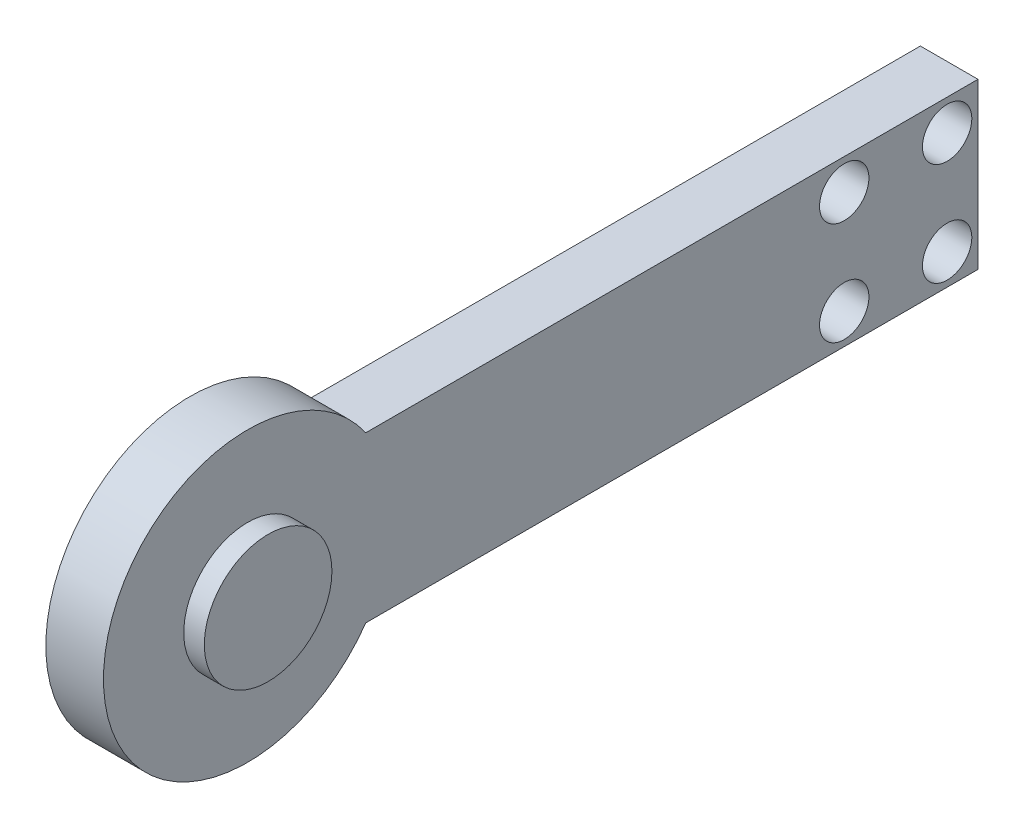
from build123d import *

# Parameters (mm, degrees)
EXTRUDE_1_DEPTH          = 14
SKETCH_4_R               = 15.5
EXTRUDE_2_DEPTH          = 5
CUT_EXTRUDE_1_DEPTH      = 182.405486002
CUT_EXTRUDE_1_DEPTH_BACK = 182.405486002
SKETCH_5_R               = 6


with BuildPart() as part:
    # 草图1 → 凸台-拉伸1 (new body)
    with BuildSketch(Plane(origin=(0, 0, 0), x_dir=(0, 0, -1), z_dir=(1, 0, 0))):
        with BuildLine():
            Line((177.445626465, -20), (28.722813233, -20))
            ThreePointArc((28.722813233, -20), (-35, 0), (28.722813233, 20))
            Line((28.722813233, 20), (177.445626465, 20))
            Line((177.445626465, 20), (177.445626465, -20))
        make_face()
    extrude(amount=EXTRUDE_1_DEPTH)

    # 草图4 → 凸台-拉伸2 (add)
    with BuildSketch(Plane(origin=(14, 0, 0), x_dir=(0, 0, -1), z_dir=(1, 0, 0))):
        Circle(SKETCH_4_R)
    extrude(amount=EXTRUDE_2_DEPTH)

    # 草图5 → 切除-拉伸1 (cut, two sides: drawn at the far end of the back side and taken through both)
    with BuildSketch(Plane(origin=(14, 0, 0), x_dir=(0, 0, -1), z_dir=(1, 0, 0)).offset(-CUT_EXTRUDE_1_DEPTH_BACK)):
        with Locations((169.945626465, 12.5)):
            Circle(SKETCH_5_R)
        with Locations((144.945626465, 12.5)):
            Circle(SKETCH_5_R)
        with Locations((144.945626465, -12.5)):
            Circle(SKETCH_5_R)
        with Locations((169.945626465, -12.5)):
            Circle(SKETCH_5_R)
    extrude(amount=CUT_EXTRUDE_1_DEPTH + CUT_EXTRUDE_1_DEPTH_BACK, mode=Mode.SUBTRACT)


solid = part.part
